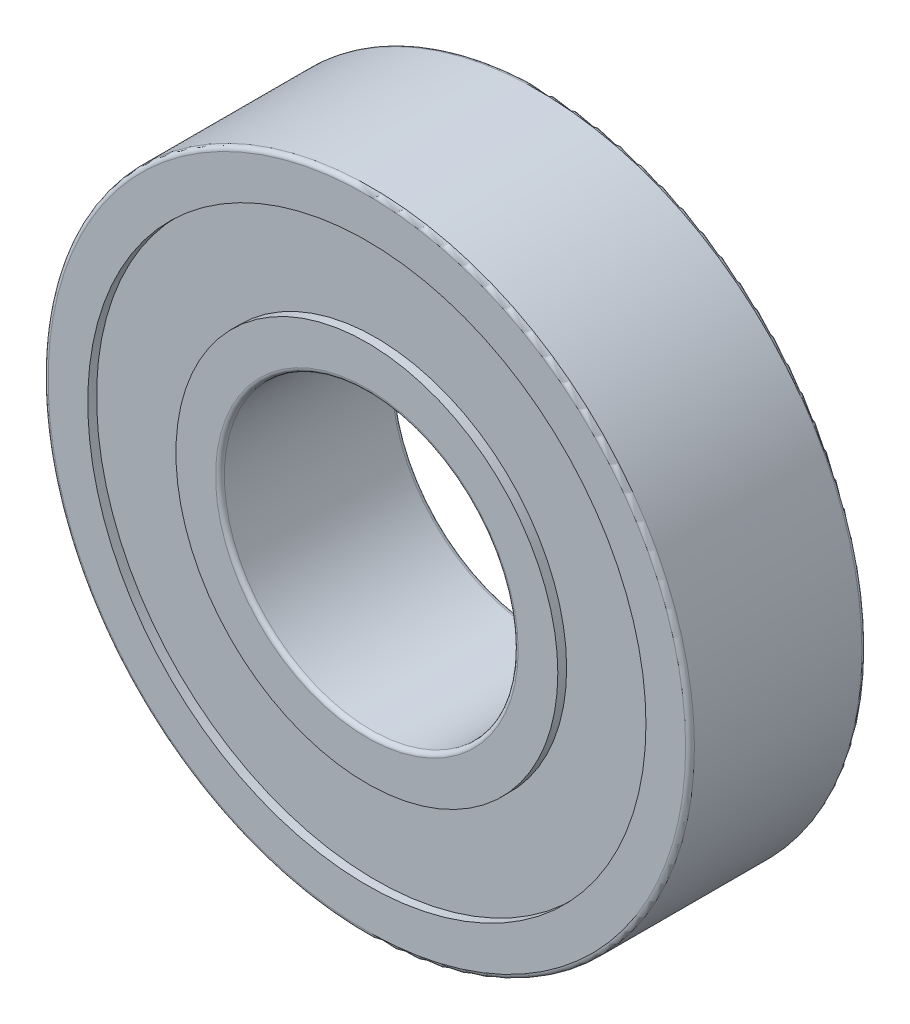
from build123d import *

# Parameters (mm, degrees)
SKETCH1_R           = 11
SKETCH1_R_2         = 5
BOSS_EXTRUDE1_DEPTH = 6
SKETCH2_R           = 9.5
SKETCH2_R_2         = 6.5
CUT_EXTRUDE1_DEPTH  = 0.3
CUT_EXTRUDE2_START  = -5.5
SKETCH2_2_R         = 9.5
SKETCH2_2_R_2       = 6.5
CUT_EXTRUDE2_DEPTH  = 0.5
FILLET1_R           = 0.15


with BuildPart() as part:
    # Sketch1 → Boss-Extrude1 (new body)
    with BuildSketch(Plane.XY):
        Circle(SKETCH1_R)
        Circle(SKETCH1_R_2, mode=Mode.SUBTRACT)
    extrude(amount=BOSS_EXTRUDE1_DEPTH)

    # Sketch2 → Cut-Extrude1 (cut)
    with BuildSketch(Plane.XY.offset(6)):
        Circle(SKETCH2_R)
        Circle(SKETCH2_R_2, mode=Mode.SUBTRACT)
    extrude(amount=-CUT_EXTRUDE1_DEPTH, mode=Mode.SUBTRACT)

    # Sketch2<2> → Cut-Extrude2 (cut)
    with BuildSketch(Plane.XY.offset(6).offset(CUT_EXTRUDE2_START)):
        Circle(SKETCH2_2_R)
        Circle(SKETCH2_2_R_2, mode=Mode.SUBTRACT)
    extrude(amount=-CUT_EXTRUDE2_DEPTH, mode=Mode.SUBTRACT)

    # Fillet1
    fillet1_edges = [part.edges().sort_by_distance(p)[0] for p in [
        (-11, 0, 0),
        (-11, 0, 6),
        (-5, 0, 0),
        (-5, 0, 6),
    ]]
    fillet(fillet1_edges, radius=FILLET1_R)


solid = part.part
